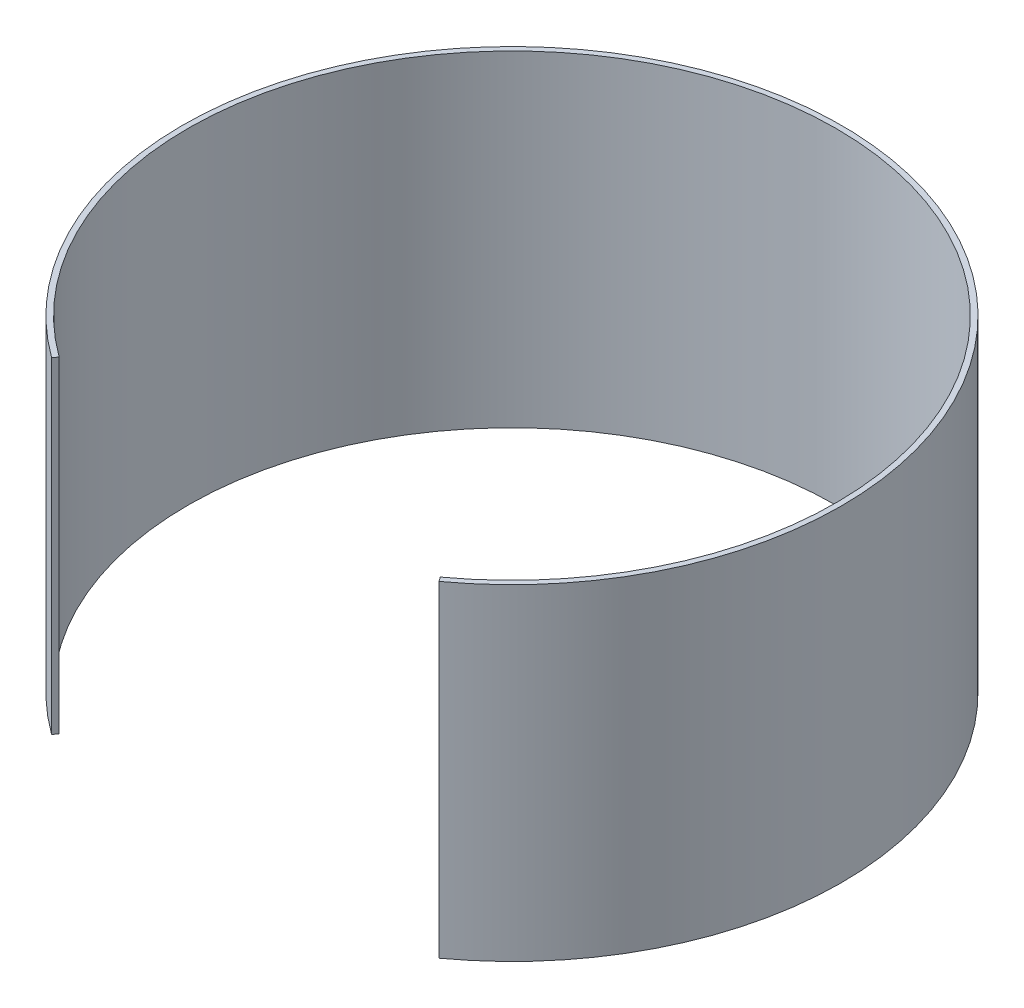
from build123d import *

# Parameters (mm, degrees)
BOSS_EXTRUDE2_DEPTH = 302


with BuildPart() as part:
    # Sketch1 → Boss-Extrude2 (new body)
    with BuildSketch(Plane(origin=(0, 0, 0), x_dir=(1, 0, 0), z_dir=(0, 1, 0))):
        with BuildLine():
            Line((176.335575688, -242.705098312), (179.274501949, -246.750183284))
            ThreePointArc((179.274501949, -246.750183284), (0, 305), (-179.274501949, -246.750183284))
            Line((-179.274501949, -246.750183284), (-176.335575688, -242.705098312))
            ThreePointArc((-176.335575688, -242.705098312), (0, 300), (176.335575688, -242.705098312))
        make_face()
    extrude(amount=BOSS_EXTRUDE2_DEPTH)


solid = part.part
